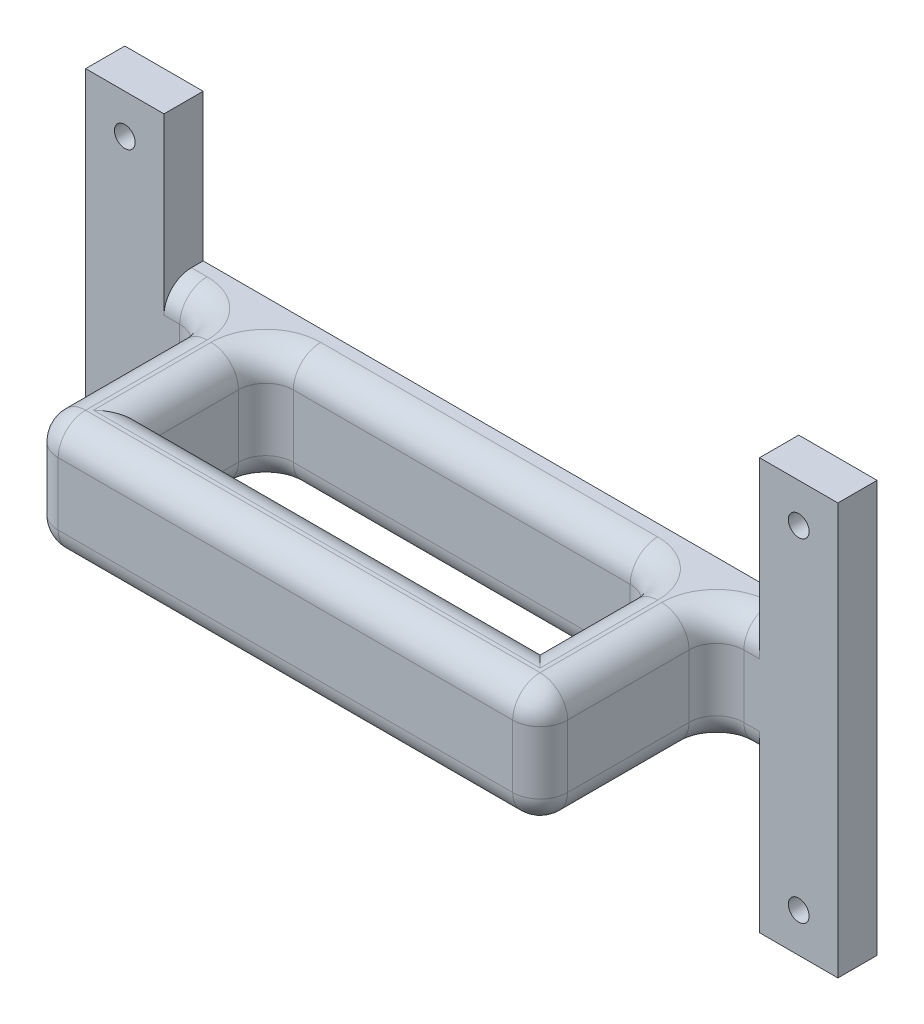
from build123d import *

# Parameters (mm, degrees)
SKETCH1_W                  = 20
SKETCH1_H                  = 37.5
SKETCH1_W_2                = 192
SKETCH1_H_2                = 30
BOSS_EXTRUDE1_DEPTH        = 10
F_4_0_209_DIAMETER_HOLE1_D = 5.3086
SKETCH6_W                  = 15
SKETCH6_H                  = 30
BOSS_EXTRUDE2_DEPTH        = 30
BOSS_EXTRUDE3_START        = 30
SKETCH6_3_W                = 100
SKETCH6_3_H                = 30
SKETCH6_3_W_2              = 15
BOSS_EXTRUDE3_DEPTH        = 15
FILLET2_R                  = 7


with BuildPart() as part:
    # Sketch1 → Boss-Extrude1 (new body)
    with BuildSketch(Plane.XY):
        with Locations((-86, 33.75)):
            Rectangle(SKETCH1_W, SKETCH1_H)
        Rectangle(SKETCH1_W_2, SKETCH1_H_2)
        with Locations((-86, -33.75)):
            Rectangle(SKETCH1_W, SKETCH1_H)
        with Locations((86, -33.75)):
            Rectangle(SKETCH1_W, SKETCH1_H)
        with Locations((86, 33.75)):
            Rectangle(SKETCH1_W, SKETCH1_H)
    extrude(amount=BOSS_EXTRUDE1_DEPTH)

    # #4 (0.209) Diameter Hole1 (through all)
    with Locations(Plane.XY.offset(10)):
        with Locations((-86, 42.5), (-86, -42.5), (86, -42.5), (86, 42.5)):
            Hole(F_4_0_209_DIAMETER_HOLE1_D / 2)

    # Sketch6 → Boss-Extrude2 (add)
    with BuildSketch(Plane.XY.offset(10)):
        with Locations((-57.5, 0)):
            Rectangle(SKETCH6_W, SKETCH6_H)
        with Locations((57.5, 0)):
            Rectangle(SKETCH6_W, SKETCH6_H)
    extrude(amount=BOSS_EXTRUDE2_DEPTH)

    # Sketch6<3> → Boss-Extrude3 (add)
    with BuildSketch(Plane.XY.offset(10).offset(BOSS_EXTRUDE3_START)):
        Rectangle(SKETCH6_3_W, SKETCH6_3_H)
        with Locations((-57.5, 0)):
            Rectangle(SKETCH6_3_W_2, SKETCH6_3_H)
        with Locations((57.5, 0)):
            Rectangle(SKETCH6_3_W_2, SKETCH6_3_H)
    extrude(amount=BOSS_EXTRUDE3_DEPTH)

    # Fillet2
    fillet2_edges = [part.edges().sort_by_distance(p)[0] for p in [
        (0, 15, 40),
        (0, -15, 40),
        (0, 15, 55),
        (-65, 0, 55),
        (0, -15, 55),
        (65, 0, 55),
        (-70.5, -15, 10),
        (-70.5, 15, 10),
        (0, -15, 10),
        (70.5, -15, 10),
        (0, 15, 10),
        (70.5, 15, 10),
        (-50, 15, 25),
        (-65, 0, 10),
        (-65, 15, 32.5),
        (-65, -15, 32.5),
        (-50, -15, 25),
        (-50, 0, 10),
        (65, -15, 32.5),
        (65, 15, 32.5),
        (50, 0, 10),
        (50, 15, 25),
        (50, -15, 25),
        (65, 0, 10),
    ]]
    fillet(fillet2_edges, radius=FILLET2_R)


solid = part.part
